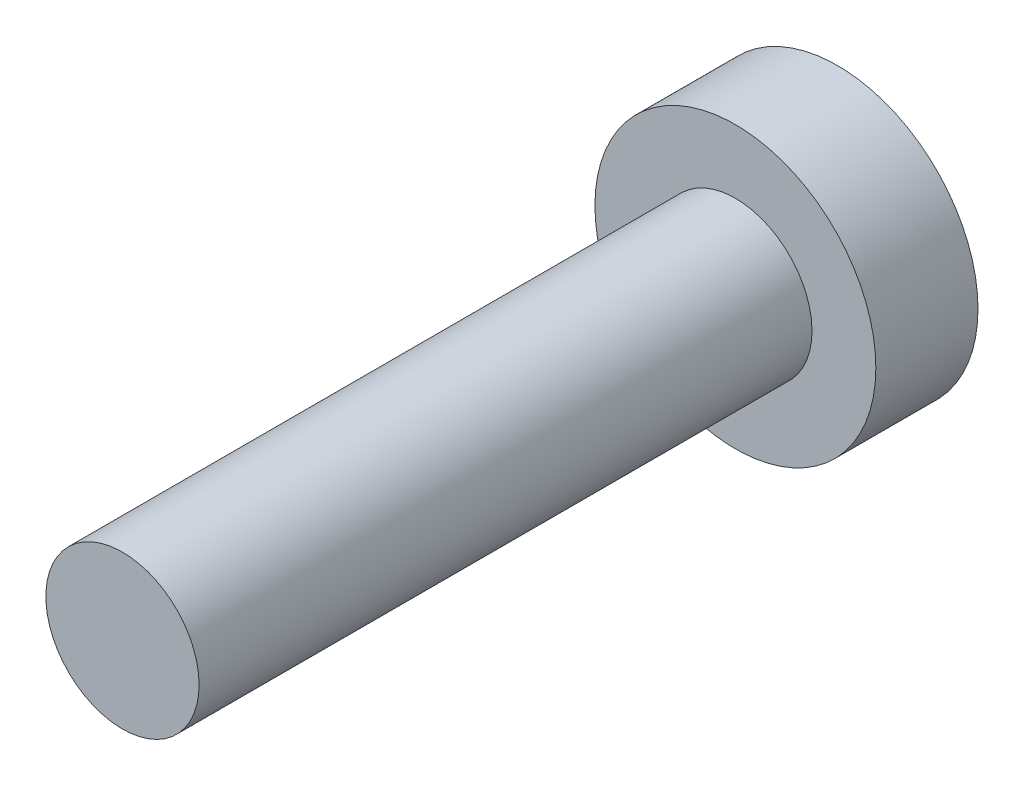
from build123d import *

# Parameters (mm, degrees)
HEAD_ENVELOPE_START         = -2
SKETCH1_R                   = 2.75
HEAD_ENVELOPE_DEPTH         = 2
SKETCH2_R                   = 1.5
THREAD_MAJOR_ENVELOPE_DEPTH = 12


with BuildPart() as part:
    # Sketch1 → Head_Envelope (new body)
    with BuildSketch(Plane.XY.offset(HEAD_ENVELOPE_START)):
        Circle(SKETCH1_R)
    extrude(amount=HEAD_ENVELOPE_DEPTH)

    # Sketch2 → Thread_Major_Envelope (add)
    with BuildSketch(Plane.XY):
        Circle(SKETCH2_R)
    extrude(amount=THREAD_MAJOR_ENVELOPE_DEPTH)


solid = part.part
